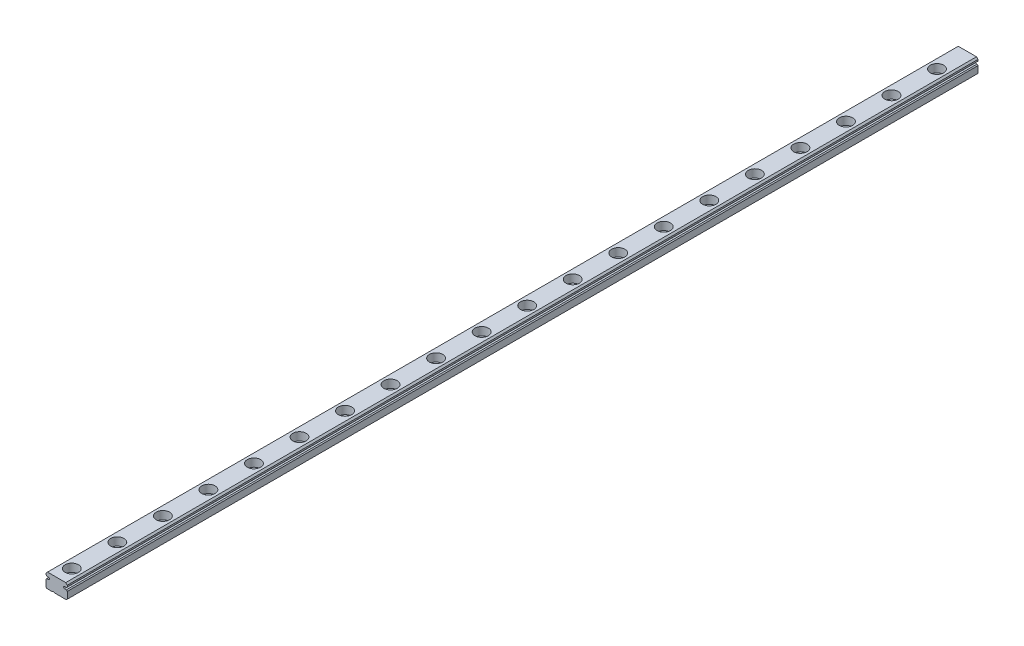
from build123d import *

# Parameters (mm, degrees)
BOSS_EXTRUDE1_DEPTH            = 150
CHAMFER1_SIZE                  = 0.5
CHAMFER2_SIZE                  = 0.3
CBORE_FOR_M2_SHCS1_D           = 2.4
CBORE_FOR_M2_SHCS1_CBORE_D     = 4.4
CBORE_FOR_M2_SHCS1_CBORE_DEPTH = 2.65
LPATTERN1_COUNT                = 20
LPATTERN1_PITCH                = 15


with BuildPart() as part:
    # Sketch3 → Boss-Extrude1 (new, symmetric)
    with BuildSketch(Plane.XY):
        with BuildLine():
            Line((-3.5, 0), (-1.35, 0))
            ThreePointArc((-1.35, 0), (-1, 0.142928579), (-0.65, 0))
            Line((-0.65, 0), (3.5, 0))
            Line((3.5, 0), (3.5, 2.83))
            Line((3.5, 2.83), (2.65, 2.83))
            ThreePointArc((2.65, 2.83), (2.315, 3.165), (2.65, 3.5))
            Line((2.65, 3.5), (3.5, 3.5))
            Line((3.5, 3.5), (3.5, 4.8))
            Line((3.5, 4.8), (-3.5, 4.8))
            Line((-3.5, 4.8), (-3.5, 3.5))
            Line((-3.5, 3.5), (-2.65, 3.5))
            ThreePointArc((-2.65, 3.5), (-2.315, 3.165), (-2.65, 2.83))
            Line((-2.65, 2.83), (-3.5, 2.83))
            Line((-3.5, 2.83), (-3.5, 0))
        make_face()
    extrude(amount=BOSS_EXTRUDE1_DEPTH, both=True)

    # Chamfer1
    chamfer1_edges = [part.edges().sort_by_distance(p)[0] for p in [
        (-3.5, 4.8, 0),
        (3.5, 4.8, 0),
    ]]
    chamfer(chamfer1_edges, length=CHAMFER1_SIZE)

    # Chamfer2
    chamfer2_edges = [part.edges().sort_by_distance(p)[0] for p in [
        (-3.5, 2.83, 0),
        (-3.5, 3.5, 0),
        (3.5, 3.5, 0),
        (3.5, 2.83, 0),
        (3.5, 0, 0),
        (-3.5, 0, 0),
    ]]
    chamfer(chamfer2_edges, length=CHAMFER2_SIZE)

    # CBORE for M2 SHCS1 (through all)
    with Locations(Plane(origin=(0, 4.8, 0), x_dir=(1, 0, 0), z_dir=(0, 1, 0))):
        with Locations((0, -145)):
            cbore_for_m2_shcs1 = CounterBoreHole(CBORE_FOR_M2_SHCS1_D / 2, CBORE_FOR_M2_SHCS1_CBORE_D / 2, CBORE_FOR_M2_SHCS1_CBORE_DEPTH)

    # LPattern1: CBORE for M2 SHCS1 ×20
    with Locations(*[(0, 0, -i * LPATTERN1_PITCH) for i in range(1, LPATTERN1_COUNT)]):
        add(cbore_for_m2_shcs1, mode=Mode.SUBTRACT)


solid = part.part
